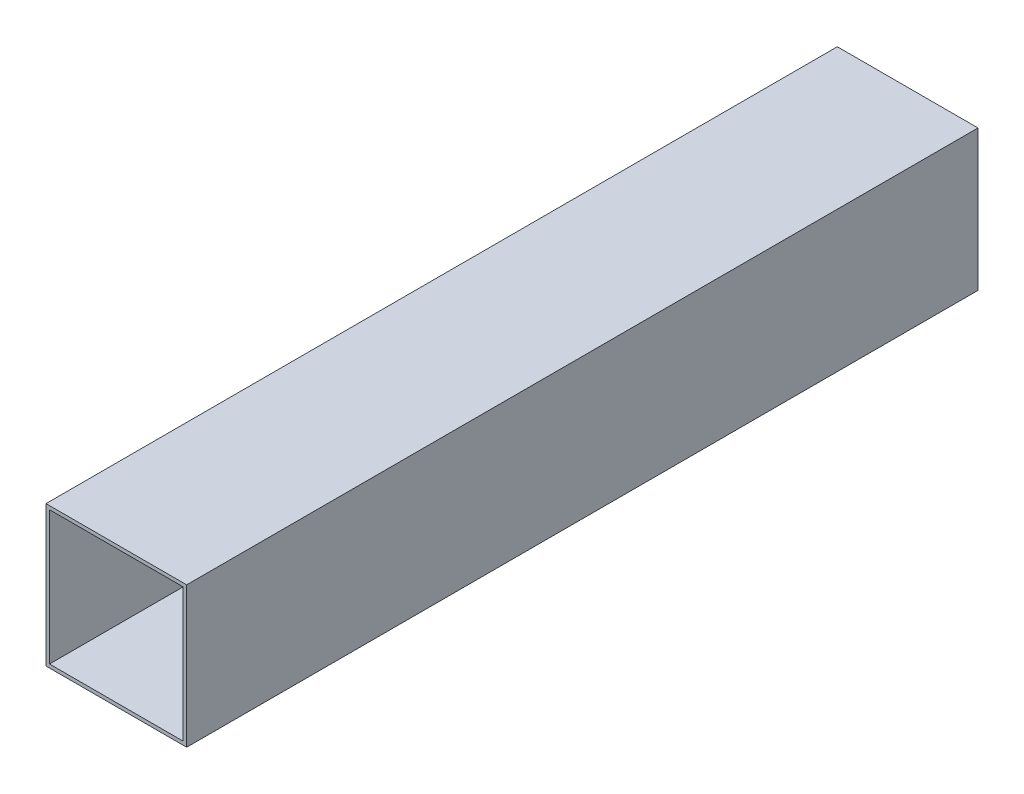
from build123d import *

# Parameters (mm, degrees)
SKETCH_1_W      = 40
SKETCH_1_H      = 40
SKETCH_1_W_2    = 38
SKETCH_1_H_2    = 38
EXTRUDE_1_DEPTH = 225


with BuildPart() as part:
    # 草图1 → 凸台-拉伸1 (new body)
    with BuildSketch(Plane.XY):
        with Locations((20, 20)):
            Rectangle(SKETCH_1_W, SKETCH_1_H)
        with Locations((20, 20)):
            Rectangle(SKETCH_1_W_2, SKETCH_1_H_2, mode=Mode.SUBTRACT)
    extrude(amount=EXTRUDE_1_DEPTH)


solid = part.part
